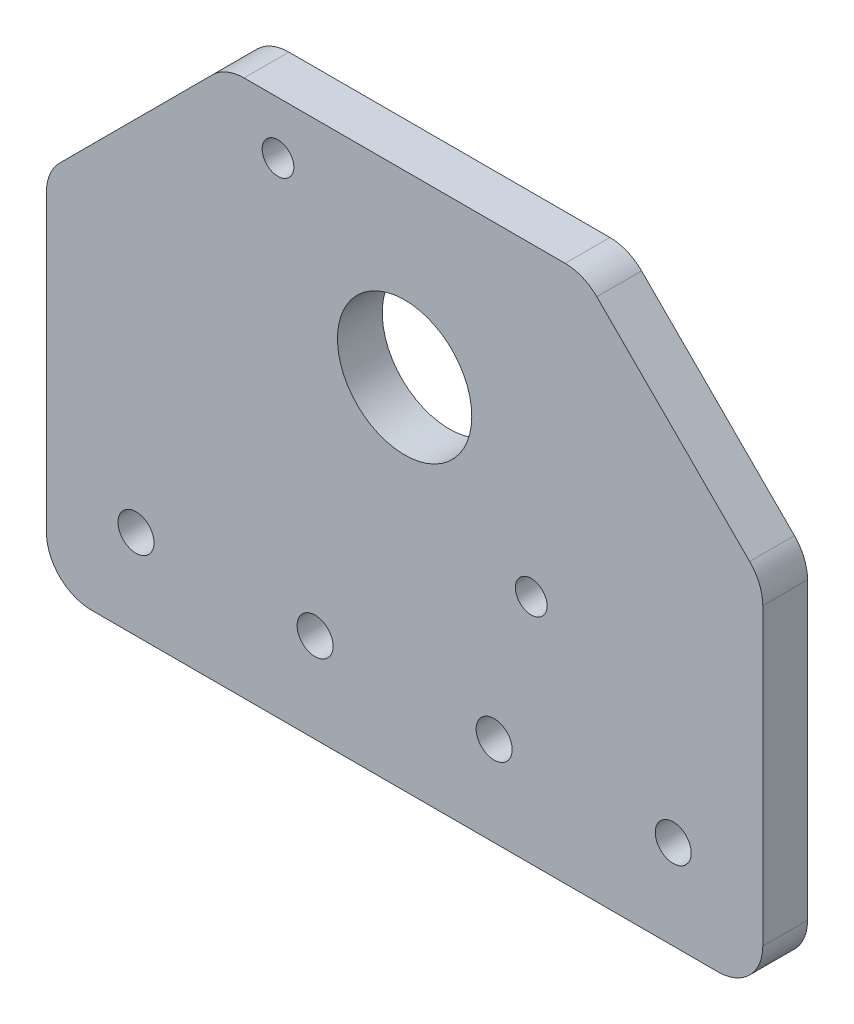
from build123d import *

# Parameters (mm, degrees)
SKETCH1_W              = 101.6
SKETCH1_H              = 76.2
SKETCH1_R              = 9.525
BOSS_EXTRUDE1_DEPTH    = 3.175
F_8_CLEARANCE_HOLE1_D  = 4.4958
CHAMFER1_SIZE          = 25.4
F_10_CLEARANCE_HOLE2_D = 5.1054
FILLET1_R              = 6.35


with BuildPart() as part:
    # Sketch1 → Boss-Extrude1 (new, symmetric)
    with BuildSketch(Plane.XY):
        with Locations((0, -12.7)):
            Rectangle(SKETCH1_W, SKETCH1_H)
        Circle(SKETCH1_R, mode=Mode.SUBTRACT)
    extrude(amount=BOSS_EXTRUDE1_DEPTH, both=True)

    # #8 Clearance Hole1 (through all)
    with Locations(Plane.XY.offset(3.175)):
        with Locations((-17.960512242, 17.960512242), (17.960512242, -17.960512242)):
            Hole(F_8_CLEARANCE_HOLE1_D / 2)

    # Chamfer1
    chamfer1_edges = [part.edges().sort_by_distance(p)[0] for p in [
        (-50.8, 25.4, 0),
        (50.8, 25.4, 0),
    ]]
    chamfer(chamfer1_edges, length=CHAMFER1_SIZE)

    # #10 Clearance Hole2 (through all)
    with Locations(Plane.XY.offset(3.175)):
        with Locations((-38.1, -38.1), (-12.7, -38.1), (12.7, -38.1), (38.1, -38.1)):
            Hole(F_10_CLEARANCE_HOLE2_D / 2)

    # Fillet1
    fillet1_edges = [part.edges().sort_by_distance(p)[0] for p in [
        (-25.4, 25.4, 0),
        (25.4, 25.4, 0),
        (50.8, 0, 0),
        (-50.8, 0, 0),
        (50.8, -50.8, 0),
        (-50.8, -50.8, 0),
    ]]
    fillet(fillet1_edges, radius=FILLET1_R)


solid = part.part
